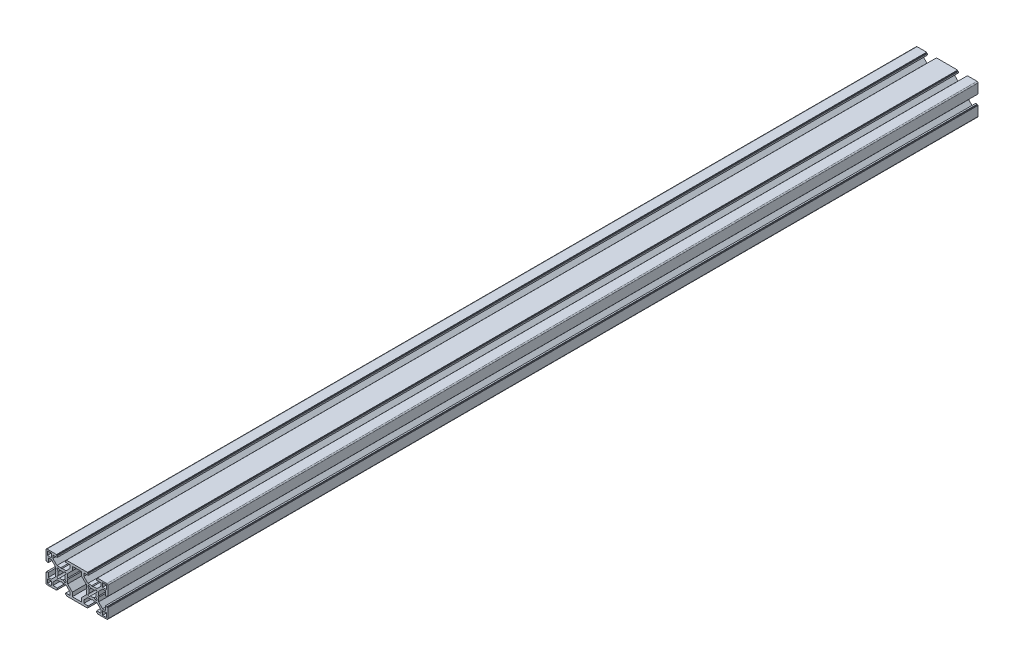
from build123d import *

# Parameters (mm, degrees)
SKETCH22_W                 = 3.960773678
SKETCH22_H                 = 3.960773678
T_SLOT_CNCCAT_3060_1_DEPTH = 843


with BuildPart() as part:
    # Sketch22 → T-slot CNCCAT-3060(1) (new body)
    with BuildSketch(Plane(origin=(0, 0, 0), x_dir=(1, 0, 0), z_dir=(0, 0, -1))):
        with BuildLine():
            Line((-20.337121873, 0), (-20.956716316, -0.619594443))
            Line((-20.956716316, -0.619594443), (-20.956716316, -4.401081398))
            Line((-20.956716316, -4.401081398), (-24.863654578, -8.30801966))
            Line((-24.863654578, -8.30801966), (-27.8, -8.30801966))
            Line((-27.8, -8.30801966), (-27.8, -4.1))
            Line((-27.8, -4.1), (-29.233870922, -4.1))
            Line((-29.233870922, -4.1), (-29.233870922, -4.756280561))
            Line((-29.233870922, -4.756280561), (-30, -4.756280561))
            Line((-30, -4.756280561), (-30, -14))
            ThreePointArc((-30, -14), (-29.707106781, -14.707106781), (-29, -15))
            Line((-29, -15), (-19.756280561, -15))
            Line((-19.756280561, -15), (-19.756280561, -14.233870922))
            Line((-19.756280561, -14.233870922), (-19.1, -14.233870922))
            Line((-19.1, -14.233870922), (-19.1, -12.8))
            Line((-19.1, -12.8), (-23.30801966, -12.8))
            Line((-23.30801966, -12.8), (-23.30801966, -9.863654578))
            Line((-23.30801966, -9.863654578), (-19.401081398, -5.956716316))
            Line((-19.401081398, -5.956716316), (-15.619594443, -5.956716316))
            Line((-15.619594443, -5.956716316), (-15, -5.337121873))
            Line((-15, -5.337121873), (-14.380405557, -5.956716316))
            Line((-14.380405557, -5.956716316), (-10.598918602, -5.956716316))
            Line((-10.598918602, -5.956716316), (-6.69198034, -9.863654578))
            Line((-6.69198034, -9.863654578), (-6.69198034, -12.8))
            Line((-6.69198034, -12.8), (-10.9, -12.8))
            Line((-10.9, -12.8), (-10.9, -14.233870922))
            Line((-10.9, -14.233870922), (-10.243719439, -14.233870922))
            Line((-10.243719439, -14.233870922), (-10.243719439, -15))
            Line((-10.243719439, -15), (10.243719439, -15))
            Line((10.243719439, -15), (10.243719439, -14.233870922))
            Line((10.243719439, -14.233870922), (10.9, -14.233870922))
            Line((10.9, -14.233870922), (10.9, -12.8))
            Line((10.9, -12.8), (6.69198034, -12.8))
            Line((6.69198034, -12.8), (6.69198034, -9.863654578))
            Line((6.69198034, -9.863654578), (10.598918602, -5.956716316))
            Line((10.598918602, -5.956716316), (14.380405557, -5.956716316))
            Line((14.380405557, -5.956716316), (15, -5.337121873))
            Line((15, -5.337121873), (15.619594443, -5.956716316))
            Line((15.619594443, -5.956716316), (19.401081398, -5.956716316))
            Line((19.401081398, -5.956716316), (23.30801966, -9.863654578))
            Line((23.30801966, -9.863654578), (23.30801966, -12.8))
            Line((23.30801966, -12.8), (19.1, -12.8))
            Line((19.1, -12.8), (19.1, -14.233870922))
            Line((19.1, -14.233870922), (19.756280561, -14.233870922))
            Line((19.756280561, -14.233870922), (19.756280561, -15))
            Line((19.756280561, -15), (29, -15))
            ThreePointArc((29, -15), (29.707106781, -14.707106781), (30, -14))
            Line((30, -14), (30, -4.756280561))
            Line((30, -4.756280561), (29.233870922, -4.756280561))
            Line((29.233870922, -4.756280561), (29.233870922, -4.1))
            Line((29.233870922, -4.1), (27.8, -4.1))
            Line((27.8, -4.1), (27.8, -8.30801966))
            Line((27.8, -8.30801966), (24.863654578, -8.30801966))
            Line((24.863654578, -8.30801966), (20.956716316, -4.401081398))
            Line((20.956716316, -4.401081398), (20.956716316, -0.619594443))
            Line((20.956716316, -0.619594443), (20.337121873, 0))
            Line((20.337121873, 0), (20.956716316, 0.619594443))
            Line((20.956716316, 0.619594443), (20.956716316, 4.401081398))
            Line((20.956716316, 4.401081398), (24.863654578, 8.30801966))
            Line((24.863654578, 8.30801966), (27.8, 8.30801966))
            Line((27.8, 8.30801966), (27.8, 4.1))
            Line((27.8, 4.1), (29.233870922, 4.1))
            Line((29.233870922, 4.1), (29.233870922, 4.756280561))
            Line((29.233870922, 4.756280561), (30, 4.756280561))
            Line((30, 4.756280561), (30, 14))
            ThreePointArc((30, 14), (29.707106781, 14.707106781), (29, 15))
            Line((29, 15), (19.756280561, 15))
            Line((19.756280561, 15), (19.756280561, 14.233870922))
            Line((19.756280561, 14.233870922), (19.1, 14.233870922))
            Line((19.1, 14.233870922), (19.1, 12.8))
            Line((19.1, 12.8), (23.30801966, 12.8))
            Line((23.30801966, 12.8), (23.30801966, 9.863654578))
            Line((23.30801966, 9.863654578), (19.401081398, 5.956716316))
            Line((19.401081398, 5.956716316), (15.619594443, 5.956716316))
            Line((15.619594443, 5.956716316), (15, 5.337121873))
            Line((15, 5.337121873), (14.380405557, 5.956716316))
            Line((14.380405557, 5.956716316), (10.598918602, 5.956716316))
            Line((10.598918602, 5.956716316), (6.69198034, 9.863654578))
            Line((6.69198034, 9.863654578), (6.69198034, 12.8))
            Line((6.69198034, 12.8), (10.9, 12.8))
            Line((10.9, 12.8), (10.9, 14.233870922))
            Line((10.9, 14.233870922), (10.243719439, 14.233870922))
            Line((10.243719439, 14.233870922), (10.243719439, 15))
            Line((10.243719439, 15), (-10.243719439, 15))
            Line((-10.243719439, 15), (-10.243719439, 14.233870922))
            Line((-10.243719439, 14.233870922), (-10.9, 14.233870922))
            Line((-10.9, 14.233870922), (-10.9, 12.8))
            Line((-10.9, 12.8), (-6.69198034, 12.8))
            Line((-6.69198034, 12.8), (-6.69198034, 9.863654578))
            Line((-6.69198034, 9.863654578), (-10.598918602, 5.956716316))
            Line((-10.598918602, 5.956716316), (-14.380405557, 5.956716316))
            Line((-14.380405557, 5.956716316), (-15, 5.337121873))
            Line((-15, 5.337121873), (-15.619594443, 5.956716316))
            Line((-15.619594443, 5.956716316), (-19.401081398, 5.956716316))
            Line((-19.401081398, 5.956716316), (-23.30801966, 9.863654578))
            Line((-23.30801966, 9.863654578), (-23.30801966, 12.8))
            Line((-23.30801966, 12.8), (-19.1, 12.8))
            Line((-19.1, 12.8), (-19.1, 14.233870922))
            Line((-19.1, 14.233870922), (-19.756280561, 14.233870922))
            Line((-19.756280561, 14.233870922), (-19.756280561, 15))
            Line((-19.756280561, 15), (-29, 15))
            ThreePointArc((-29, 15), (-29.707106781, 14.707106781), (-30, 14))
            Line((-30, 14), (-30, 4.756280561))
            Line((-30, 4.756280561), (-29.233870922, 4.756280561))
            Line((-29.233870922, 4.756280561), (-29.233870922, 4.1))
            Line((-29.233870922, 4.1), (-27.8, 4.1))
            Line((-27.8, 4.1), (-27.8, 8.30801966))
            Line((-27.8, 8.30801966), (-24.863654578, 8.30801966))
            Line((-24.863654578, 8.30801966), (-20.956716316, 4.401081398))
            Line((-20.956716316, 4.401081398), (-20.956716316, 0.619594443))
            Line((-20.956716316, 0.619594443), (-20.337121873, 0))
        make_face()
        with Locations((26.75, 11.75)):
            Rectangle(SKETCH22_W, SKETCH22_H, mode=Mode.SUBTRACT)
        with BuildLine():
            Line((19.109450474, -2.695236912), (18.078815026, -1.664601464))
            ThreePointArc((18.078815026, -1.664601464), (18.5, 0), (18.078815026, 1.664601464))
            Line((18.078815026, 1.664601464), (19.109450474, 2.695236912))
            ThreePointArc((19.109450474, 2.695236912), (19.109450474, 4.109450474), (17.695236912, 4.109450474))
            Line((17.695236912, 4.109450474), (16.664601464, 3.078815026))
            ThreePointArc((16.664601464, 3.078815026), (15, 3.5), (13.335398536, 3.078815026))
            Line((13.335398536, 3.078815026), (12.304763088, 4.109450474))
            ThreePointArc((12.304763088, 4.109450474), (10.890549526, 4.109450474), (10.890549526, 2.695236912))
            Line((10.890549526, 2.695236912), (11.921184974, 1.664601464))
            ThreePointArc((11.921184974, 1.664601464), (11.5, 0), (11.921184974, -1.664601464))
            Line((11.921184974, -1.664601464), (10.890549526, -2.695236912))
            ThreePointArc((10.890549526, -2.695236912), (10.890549526, -4.109450474), (12.304763088, -4.109450474))
            Line((12.304763088, -4.109450474), (13.335398536, -3.078815026))
            ThreePointArc((13.335398536, -3.078815026), (15, -3.5), (16.664601464, -3.078815026))
            Line((16.664601464, -3.078815026), (17.695236912, -4.109450474))
            ThreePointArc((17.695236912, -4.109450474), (19.109450474, -4.109450474), (19.109450474, -2.695236912))
        make_face(mode=Mode.SUBTRACT)
        Polygon((-4.49198034, -12.8), (4.49198034, -12.8), (4.49198034, -8.952384741), (9.043283684, -4.401081398), (9.043283684, -0.619594443), (9.662878127, 0), (9.043283684, 0.619594443), (9.043283684, 4.401081398), (4.49198034, 8.952384741), (4.49198034, 12.8), (-4.49198034, 12.8), (-4.49198034, 8.952384741), (-9.043283684, 4.401081398), (-9.043283684, 0.619594443), (-9.662878127, 0), (-9.043283684, -0.619594443), (-9.043283684, -4.401081398), (-4.49198034, -8.952384741), align=None, mode=Mode.SUBTRACT)
        with Locations((26.75, -11.75)):
            Rectangle(SKETCH22_W, SKETCH22_H, mode=Mode.SUBTRACT)
        with Locations((-26.75, 11.75)):
            Rectangle(SKETCH22_W, SKETCH22_H, mode=Mode.SUBTRACT)
        with BuildLine():
            Line((-19.109450474, 2.695236912), (-18.078815026, 1.664601464))
            ThreePointArc((-18.078815026, 1.664601464), (-18.5, 0), (-18.078815026, -1.664601464))
            Line((-18.078815026, -1.664601464), (-19.109450474, -2.695236912))
            ThreePointArc((-19.109450474, -2.695236912), (-19.109450474, -4.109450474), (-17.695236912, -4.109450474))
            Line((-17.695236912, -4.109450474), (-16.664601464, -3.078815026))
            ThreePointArc((-16.664601464, -3.078815026), (-15, -3.5), (-13.335398536, -3.078815026))
            Line((-13.335398536, -3.078815026), (-12.304763088, -4.109450474))
            ThreePointArc((-12.304763088, -4.109450474), (-10.890549526, -4.109450474), (-10.890549526, -2.695236912))
            Line((-10.890549526, -2.695236912), (-11.921184974, -1.664601464))
            ThreePointArc((-11.921184974, -1.664601464), (-11.5, 0), (-11.921184974, 1.664601464))
            Line((-11.921184974, 1.664601464), (-10.890549526, 2.695236912))
            ThreePointArc((-10.890549526, 2.695236912), (-10.890549526, 4.109450474), (-12.304763088, 4.109450474))
            Line((-12.304763088, 4.109450474), (-13.335398536, 3.078815026))
            ThreePointArc((-13.335398536, 3.078815026), (-15, 3.5), (-16.664601464, 3.078815026))
            Line((-16.664601464, 3.078815026), (-17.695236912, 4.109450474))
            ThreePointArc((-17.695236912, 4.109450474), (-19.109450474, 4.109450474), (-19.109450474, 2.695236912))
        make_face(mode=Mode.SUBTRACT)
        with Locations((-26.75, -11.75)):
            Rectangle(SKETCH22_W, SKETCH22_H, mode=Mode.SUBTRACT)
    extrude(amount=T_SLOT_CNCCAT_3060_1_DEPTH)


solid = part.part
